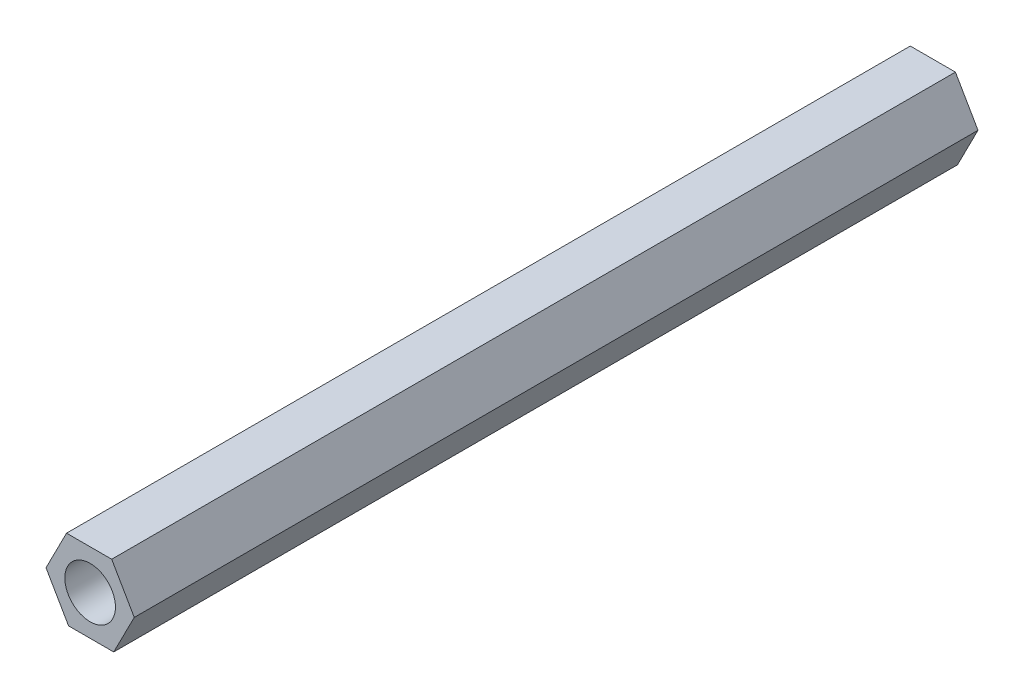
from build123d import *

# Parameters (mm, degrees)
EXTRUDE_1_DEPTH     = 50
SKETCH_2_R          = 1.5
CUT_EXTRUDE_1_DEPTH = 50


with BuildPart() as part:
    # 草图1 → 凸台-拉伸1 (new body)
    with BuildSketch(Plane.XY):
        Polygon((0, 0), (2.675718911, 0), (4.013578367, -2.317240551), (2.796233264, -4.7), (0.120514353, -4.7), (-1.217345103, -2.382759449), align=None)
    extrude(amount=EXTRUDE_1_DEPTH)

    # 草图2 → 切除-拉伸1 (cut)
    with BuildSketch(Plane.XY):
        with Locations((1.398116632, -2.35)):
            Circle(SKETCH_2_R)
    extrude(amount=CUT_EXTRUDE_1_DEPTH, mode=Mode.SUBTRACT)


solid = part.part
